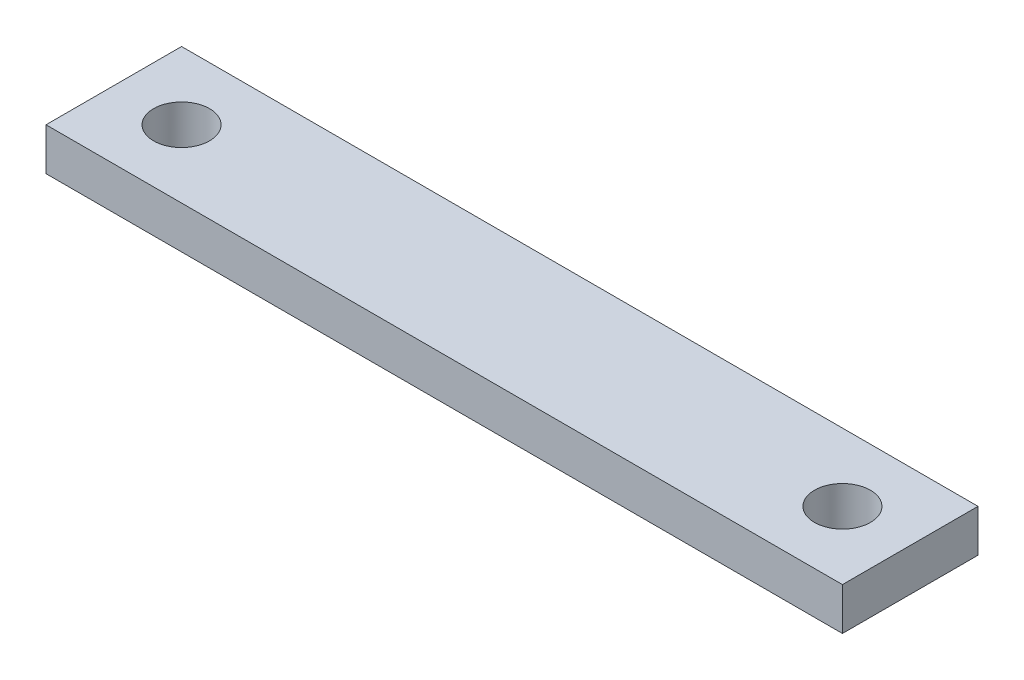
from build123d import *

# Parameters (mm, degrees)
SKETCH1_W           = 47
SKETCH1_H           = 8
BOSS_EXTRUDE1_DEPTH = 2.5
SKETCH2_R           = 1.65
CUT_EXTRUDE1_DEPTH  = 2.5


with BuildPart() as part:
    # Sketch1 → Boss-Extrude1 (new body)
    with BuildSketch(Plane(origin=(0, 0, 0), x_dir=(1, 0, 0), z_dir=(0, 1, 0))):
        with Locations((23.5, 4)):
            Rectangle(SKETCH1_W, SKETCH1_H)
    extrude(amount=BOSS_EXTRUDE1_DEPTH)

    # Sketch2 → Cut-Extrude1 (cut)
    with BuildSketch(Plane(origin=(0, 0, 0), x_dir=(1, 0, 0), z_dir=(0, 1, 0))):
        with Locations(Location((4, 4, 0), (0, 0, 90))):
            Circle(SKETCH2_R)
        with Locations(Location((43, 4, 0), (0, 0, 90))):
            Circle(SKETCH2_R)
    extrude(amount=CUT_EXTRUDE1_DEPTH, mode=Mode.SUBTRACT)


solid = part.part
